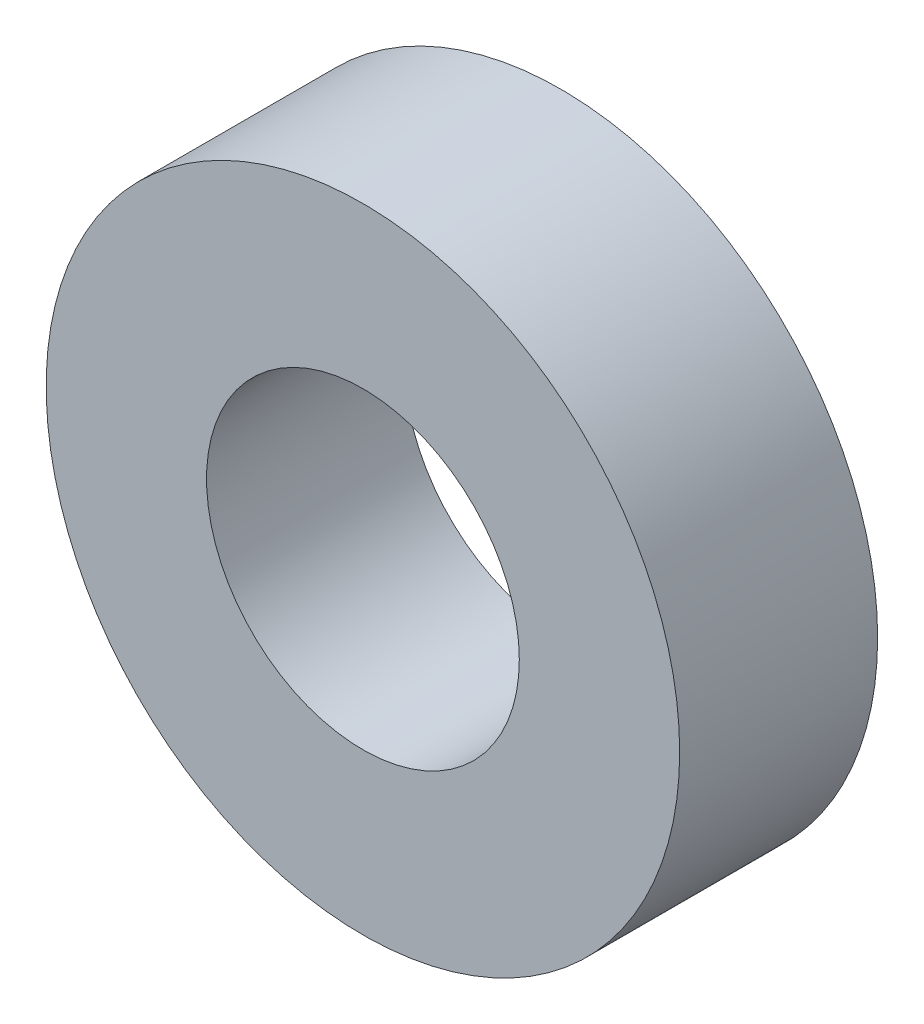
from build123d import *

# Parameters (mm, degrees)
SKETCH1_R           = 8
SKETCH1_R_2         = 3.95
BOSS_EXTRUDE1_DEPTH = 5


with BuildPart() as part:
    # Sketch1 → Boss-Extrude1 (new body)
    with BuildSketch(Plane.XY):
        Circle(SKETCH1_R)
        Circle(SKETCH1_R_2, mode=Mode.SUBTRACT)
    extrude(amount=BOSS_EXTRUDE1_DEPTH)


solid = part.part
